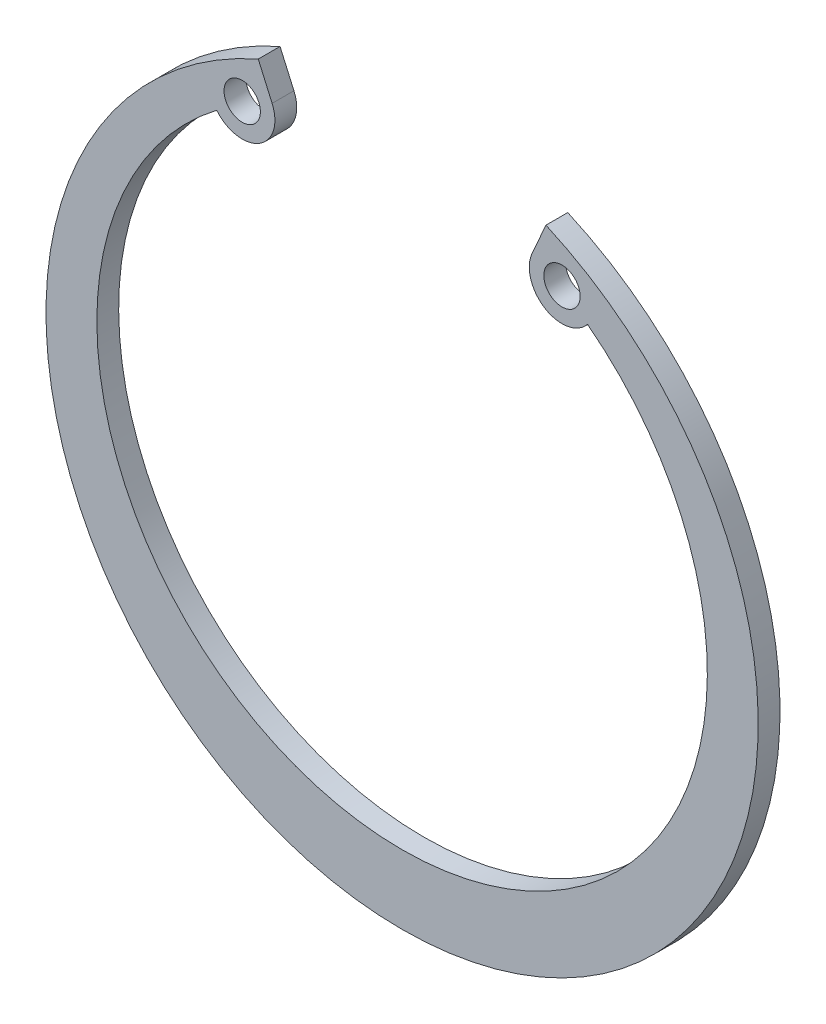
from build123d import *

# Parameters (mm, degrees)
ESQUISSE1_R      = 1.25
EXTRUSION1_DEPTH = 1.5


with BuildPart() as part:
    # Esquisse1 → Extrusion1 (new body)
    with BuildSketch(Plane.XY):
        with BuildLine():
            Line((8.941739228, 20.249575294), (9.896691771, 22.412172853))
            ThreePointArc((9.896691771, 22.412172853), (0, -24.5), (-9.896691771, 22.412172853))
            Line((-9.896691771, 22.412172853), (-8.941739228, 20.249575294))
            ThreePointArc((-8.941739228, 20.249575294), (-9.831654076, 17.417815357), (-12.754966888, 17.93265026))
            ThreePointArc((-12.754966888, 17.93265026), (0, -19.75), (12.754966888, 17.93265026))
            ThreePointArc((12.754966888, 17.93265026), (9.831654076, 17.417815357), (8.941739228, 20.249575294))
        make_face()
        with Locations((11, 19.340695437)):
            Circle(ESQUISSE1_R, mode=Mode.SUBTRACT)
        with Locations((-11, 19.340695437)):
            Circle(ESQUISSE1_R, mode=Mode.SUBTRACT)
    extrude(amount=EXTRUSION1_DEPTH)


solid = part.part
